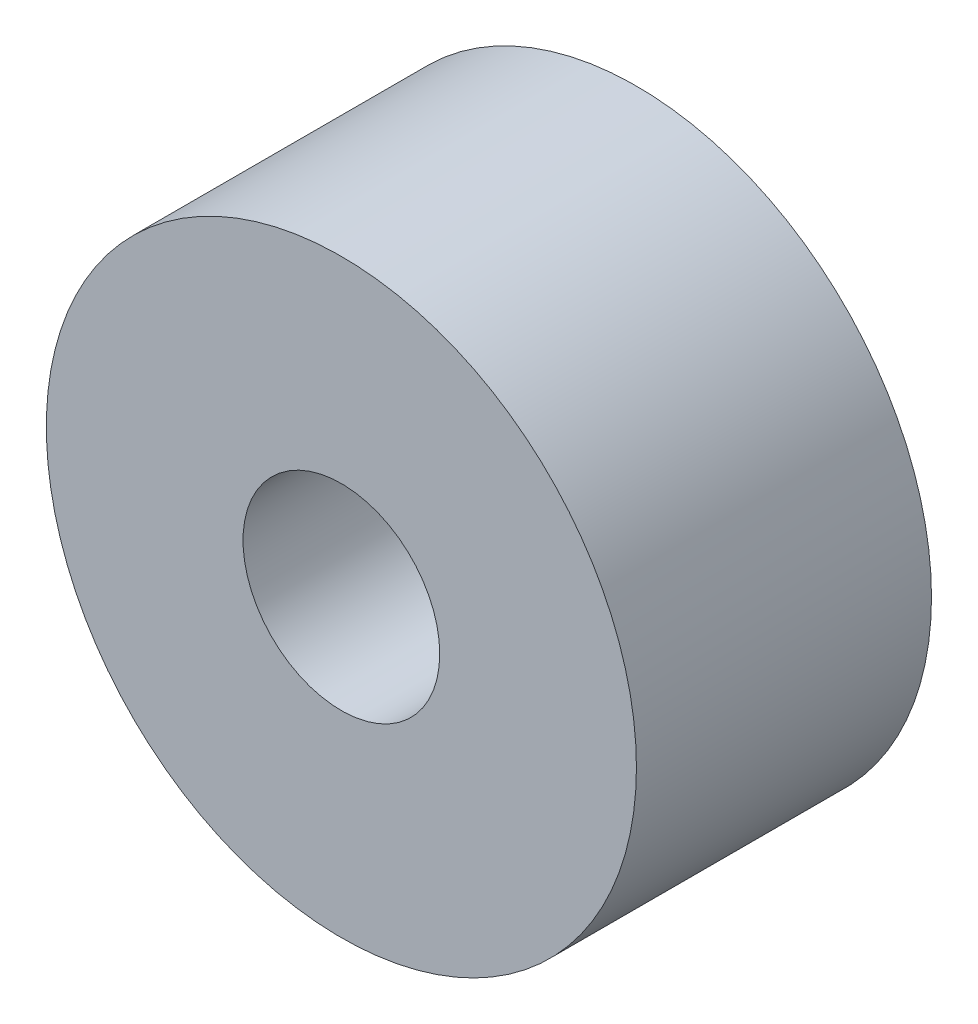
from build123d import *

# Parameters (mm, degrees)
SKETCH_1_R      = 15
SKETCH_1_R_2    = 5
EXTRUDE_1_DEPTH = 15


with BuildPart() as part:
    # 스케치1 → 보스-돌출1 (new body)
    with BuildSketch(Plane.XY):
        Circle(SKETCH_1_R)
        Circle(SKETCH_1_R_2, mode=Mode.SUBTRACT)
    extrude(amount=EXTRUDE_1_DEPTH)


solid = part.part
